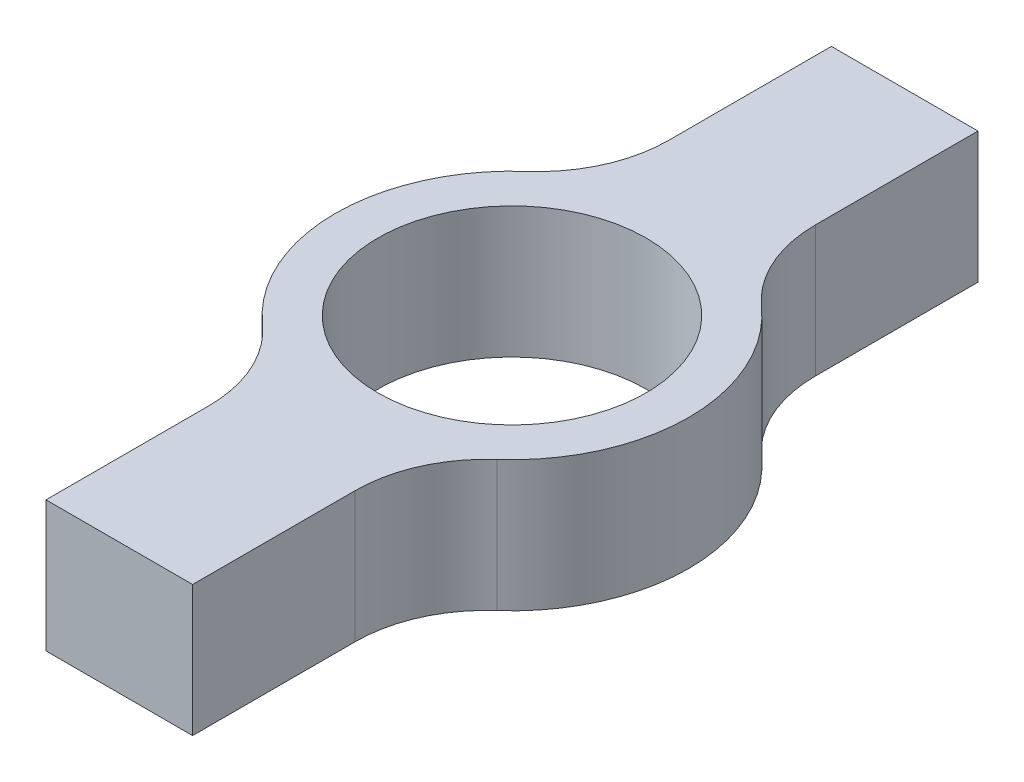
from build123d import *

# Parameters (mm, degrees)
SKETCH_1_R          = 13.5
EXTRUDE_1_DEPTH     = 10
SKETCH_2_W          = 11.2
SKETCH_2_H          = 60
EXTRUDE_2_DEPTH     = 10
SKETCH_3_R          = 10.25
CUT_EXTRUDE_1_DEPTH = 10
FILLET_1_R          = 10


with BuildPart() as part:
    # 草图1 → 凸台-拉伸1 (new body)
    with BuildSketch(Plane(origin=(0, 0, 0), x_dir=(1, 0, 0), z_dir=(0, 1, 0))):
        with Locations(Location((0, 0, 0), (0, 0, 270))):
            Circle(SKETCH_1_R)
    extrude(amount=EXTRUDE_1_DEPTH)

    # 草图2 → 凸台-拉伸2 (add)
    with BuildSketch(Plane(origin=(0, 10, 0), x_dir=(1, 0, 0), z_dir=(0, 1, 0))):
        Rectangle(SKETCH_2_W, SKETCH_2_H)
    extrude(amount=-EXTRUDE_2_DEPTH)

    # 草图3 → 切除-拉伸1 (cut)
    with BuildSketch(Plane(origin=(0, 10, 0), x_dir=(1, 0, 0), z_dir=(0, 1, 0))):
        with Locations(Location((0, 0, 0), (0, 0, 270))):
            Circle(SKETCH_3_R)
    extrude(amount=-CUT_EXTRUDE_1_DEPTH, mode=Mode.SUBTRACT)

    # 圆角1
    fillet_1_edges = [part.edges().sort_by_distance(p)[0] for p in [
        (-5.6, 5, -12.283729075),
        (-5.6, 5, 12.283729075),
        (5.6, 5, 12.283729075),
        (5.6, 5, -12.283729075),
    ]]
    fillet(fillet_1_edges, radius=FILLET_1_R)


solid = part.part
